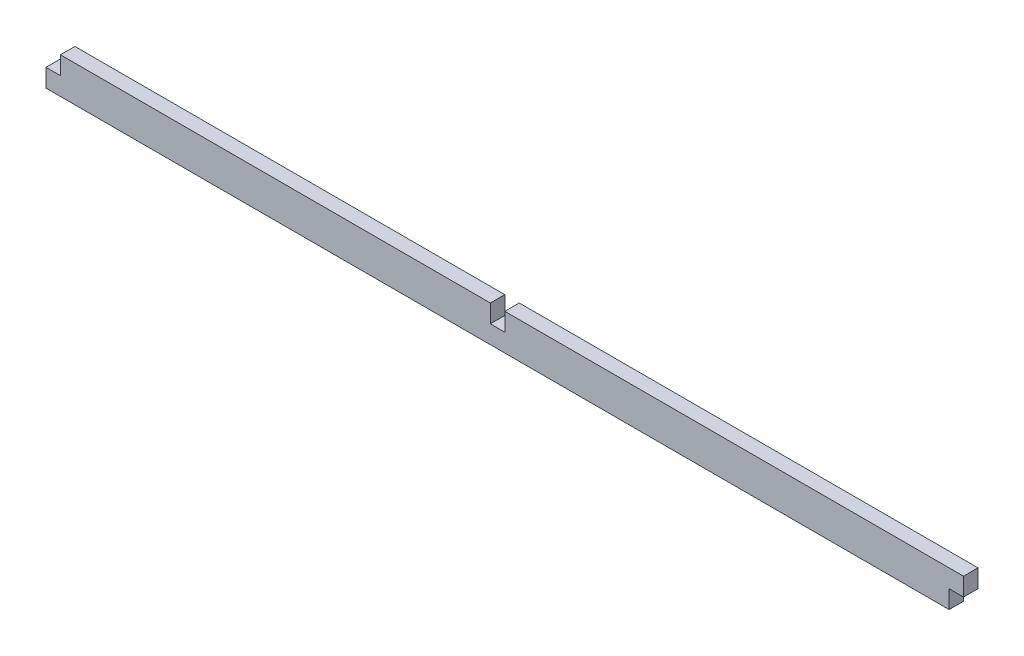
from build123d import *

# Parameters (mm, degrees)
BOSS_EXTRUDE1_DEPTH = 10


with BuildPart() as part:
    # Sketch1 → Boss-Extrude1 (new body)
    with BuildSketch(Plane.XY):
        Polygon((5, 0), (-5, 0), (-5, 12.5), (-302.5, 12.5), (-302.5, 0), (-312.5, 0), (-312.5, -12.5), (312.5, -12.5), (312.5, 0), (322.5, 0), (322.5, 12.5), (312.5, 12.5), (5, 12.5), align=None)
    extrude(amount=BOSS_EXTRUDE1_DEPTH)


solid = part.part
